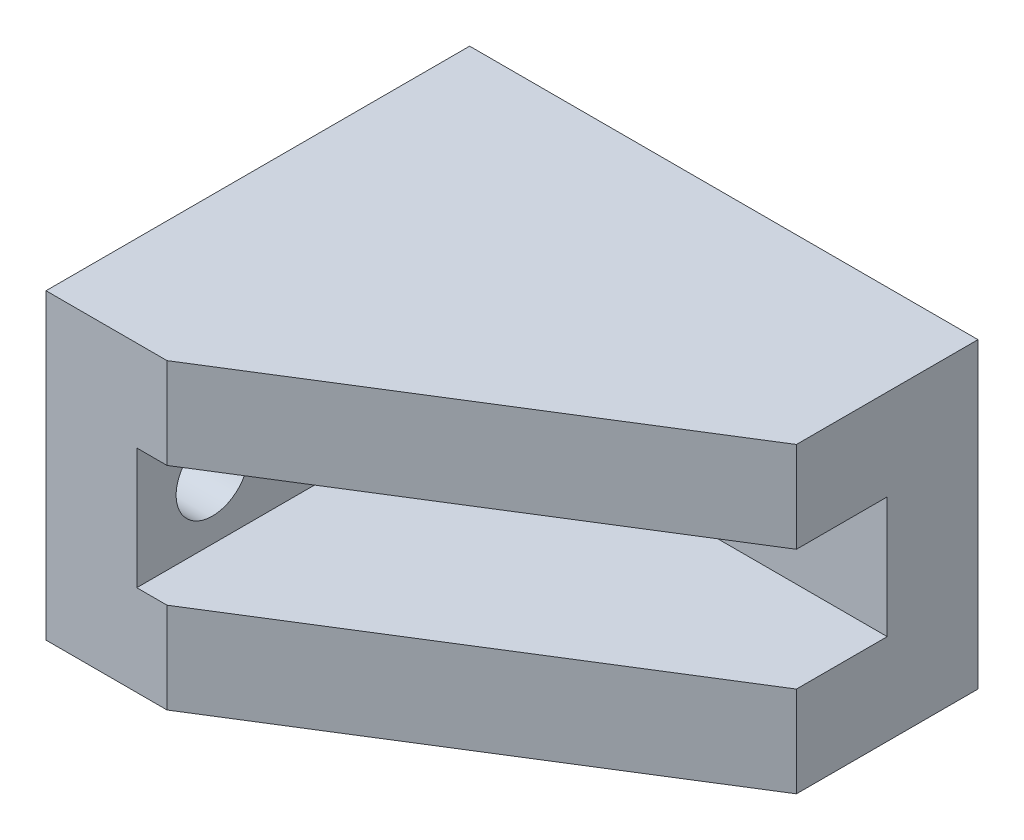
from build123d import *

# Parameters (mm, degrees)
BOSS_EXTRUDE1_DEPTH = 25
SHELL1_T            = -7.5
SKETCH3_R           = 3
CUT_EXTRUDE1_DEPTH  = 30
SKETCH4_R           = 2.5
CUT_EXTRUDE2_DEPTH  = 10


with BuildPart() as part:
    # Sketch2 → Boss-Extrude1 (new body)
    with BuildSketch(Plane(origin=(0, 0, 0), x_dir=(1, 0, 0), z_dir=(0, 1, 0))):
        Polygon((10, -35), (42, -15), (42, 0), (0, 0), (0, -35), align=None)
    extrude(amount=BOSS_EXTRUDE1_DEPTH)

    # Shell1
    shell1_openings = [part.faces().sort_by_distance(p)[0] for p in [
        (42, 12.5, 7.5),
        (26, 12.5, 25),
        (5, 12.5, 35),
    ]]
    offset(amount=SHELL1_T, openings=shell1_openings, kind=Kind.INTERSECTION)

    # Sketch3 → Cut-Extrude1 (cut)
    with BuildSketch(Plane(origin=(7.5, 0, 0), x_dir=(0, 0, -1), z_dir=(1, 0, 0))):
        with Locations((-28.75, 12.5)):
            Circle(SKETCH3_R)
        with Locations((-13.75, 12.5)):
            Circle(SKETCH3_R)
    extrude(amount=-CUT_EXTRUDE1_DEPTH, mode=Mode.SUBTRACT)

    # Sketch4 → Cut-Extrude2 (cut)
    with BuildSketch(Plane.XY.offset(7.5)):
        with Locations((17.25, 12.5)):
            Circle(SKETCH4_R)
        with Locations((32.25, 12.5)):
            Circle(SKETCH4_R)
    extrude(amount=-CUT_EXTRUDE2_DEPTH, mode=Mode.SUBTRACT)


solid = part.part
